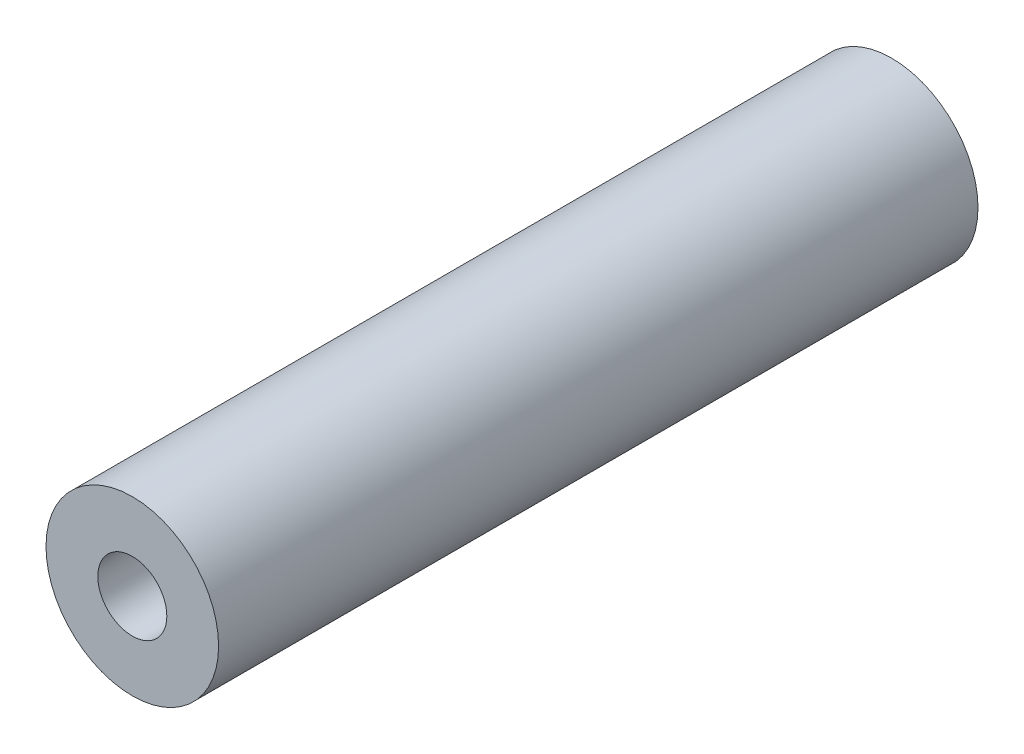
from build123d import *

# Parameters (mm, degrees)
SKETCH_1_R      = 2.5
SKETCH_1_R_2    = 1
EXTRUDE_1_DEPTH = 22


with BuildPart() as part:
    # 草图1 → 拉伸-薄壁1 (new body)
    with BuildSketch(Plane.XY):
        Circle(SKETCH_1_R)
        Circle(SKETCH_1_R_2, mode=Mode.SUBTRACT)
    extrude(amount=-EXTRUDE_1_DEPTH)


solid = part.part
